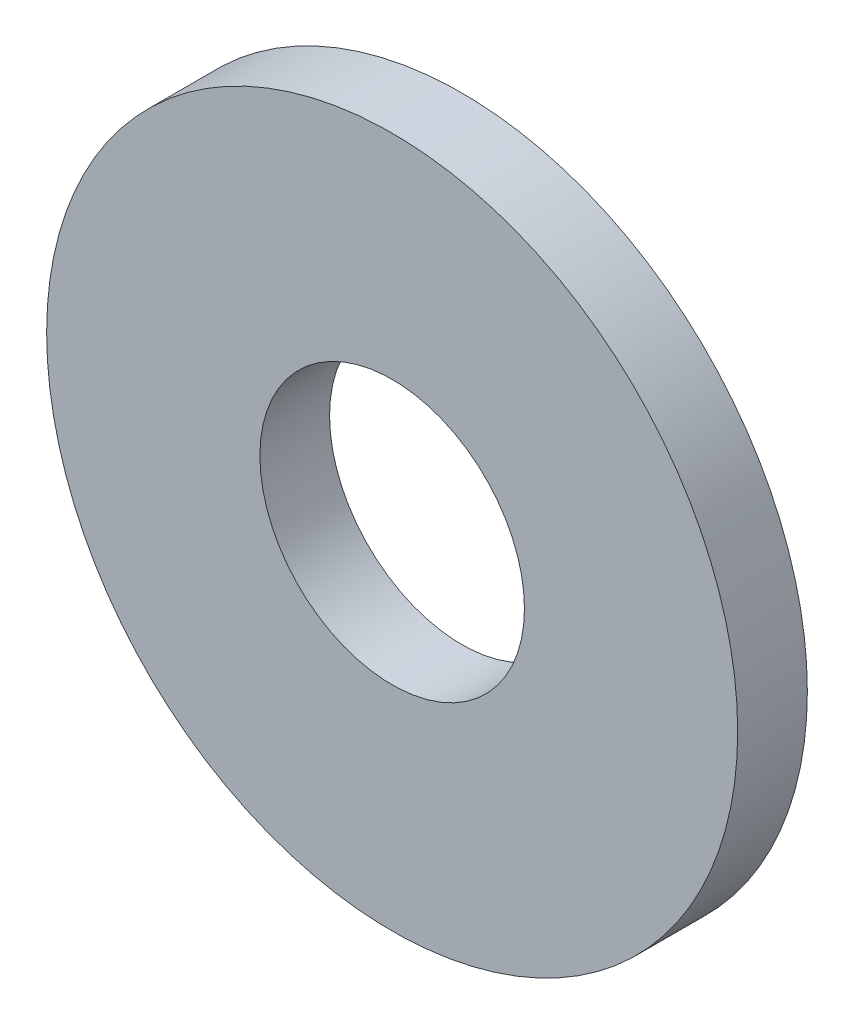
from build123d import *

# Parameters (mm, degrees)
BOSS_EXTRUDE1_DEPTH      = 0.9398
BOSS_EXTRUDE1_DEPTH_BACK = 0.9398
SKETCH3_R                = 9.3218
SKETCH3_R_2              = 3.5687


with BuildPart() as part:
    # Sketch3 → Boss-Extrude1 (new, two sides: drawn at the far end of the back side and taken through both)
    with BuildSketch(Plane.XY.offset(-BOSS_EXTRUDE1_DEPTH_BACK)):
        with Locations(Location((0, 0, 0), (0, 0, 180))):
            Circle(SKETCH3_R)
        with Locations(Location((0, 0, 0), (0, 0, 180))):
            Circle(SKETCH3_R_2, mode=Mode.SUBTRACT)
    extrude(amount=BOSS_EXTRUDE1_DEPTH + BOSS_EXTRUDE1_DEPTH_BACK)


solid = part.part
